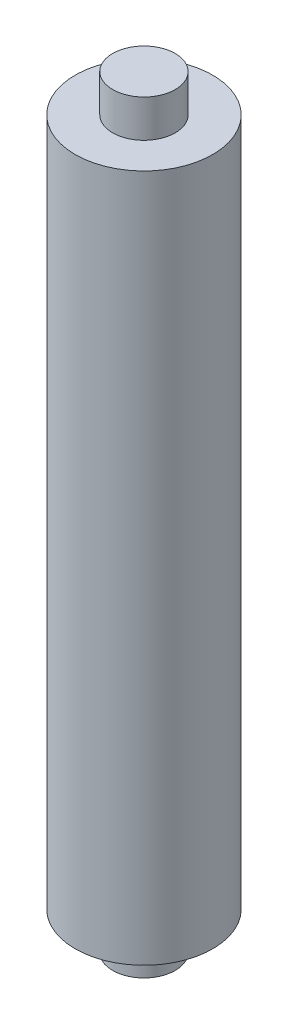
from build123d import *

# Parameters (mm, degrees)
SKETCH_1_R      = 2.5
EXTRUDE_1_DEPTH = 30.5
SKETCH_2_R      = 5.5
EXTRUDE_2_DEPTH = 27.5


with BuildPart() as part:
    # 草图1 → 凸台-拉伸1 (new, symmetric)
    with BuildSketch(Plane(origin=(0, 0, 0), x_dir=(1, 0, 0), z_dir=(0, 1, 0))):
        with Locations(Location((0, 0, 0), (0, 0, 90))):
            Circle(SKETCH_1_R)
    extrude(amount=EXTRUDE_1_DEPTH, both=True)

    # 草图2 → 凸台-拉伸2 (add, symmetric)
    with BuildSketch(Plane(origin=(0, 0, 0), x_dir=(1, 0, 0), z_dir=(0, 1, 0))):
        with Locations(Location((0, 0, 0), (0, 0, 270))):
            Circle(SKETCH_2_R)
    extrude(amount=EXTRUDE_2_DEPTH, both=True)


solid = part.part
